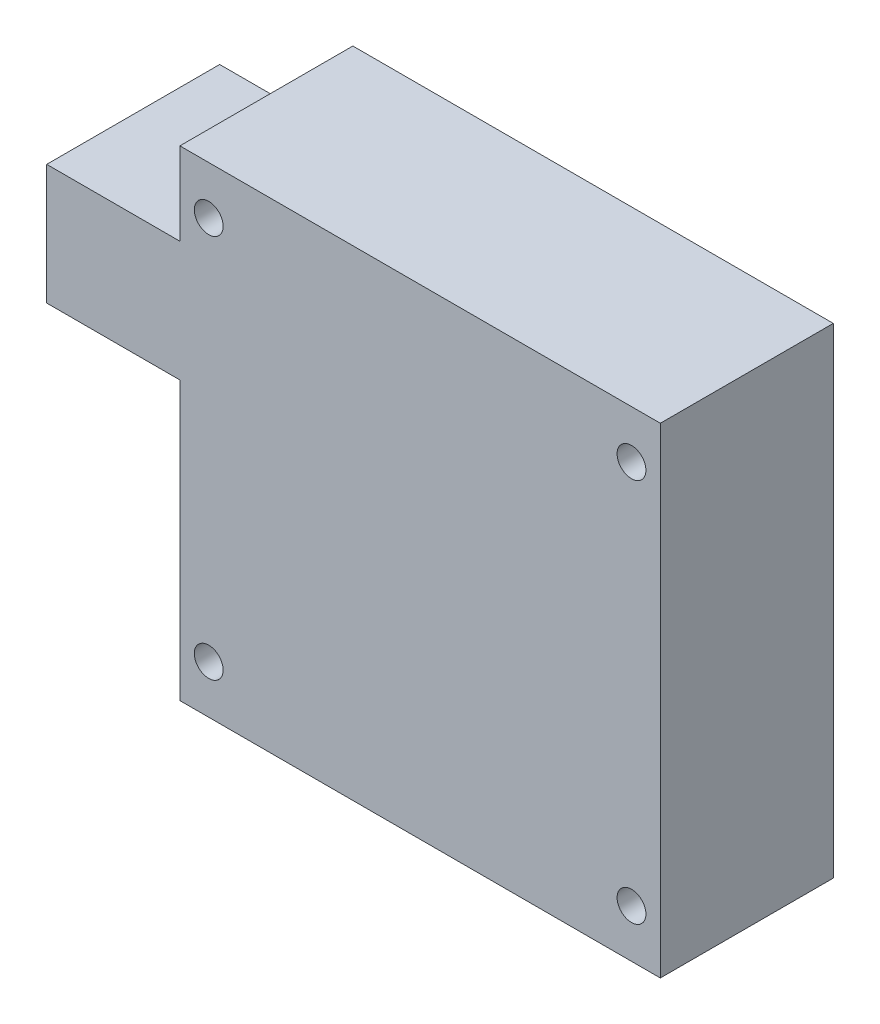
from build123d import *

# Parameters (mm, degrees)
SKETCH_1_W      = 50
SKETCH_1_H      = 50
SKETCH_1_R      = 1.5
EXTRUDE_1_DEPTH = 18
SKETCH_2_W      = 13.860098184
SKETCH_2_H      = 12.505152703
EXTRUDE_2_DEPTH = 18


with BuildPart() as part:
    # 草图1 → 凸台-拉伸1 (new body)
    with BuildSketch(Plane.XY):
        Rectangle(SKETCH_1_W, SKETCH_1_H)
        with Locations((-22, 20)):
            Circle(SKETCH_1_R, mode=Mode.SUBTRACT)
        with Locations((-22, -20)):
            Circle(SKETCH_1_R, mode=Mode.SUBTRACT)
        with Locations((22, 20)):
            Circle(SKETCH_1_R, mode=Mode.SUBTRACT)
        with Locations((22, -20)):
            Circle(SKETCH_1_R, mode=Mode.SUBTRACT)
    extrude(amount=EXTRUDE_1_DEPTH)

    # 草图2 → 凸台-拉伸2 (add)
    with BuildSketch(Plane.XY.offset(18)):
        with Locations((-31.930049092, 10.152032571)):
            Rectangle(SKETCH_2_W, SKETCH_2_H)
    extrude(amount=-EXTRUDE_2_DEPTH)


solid = part.part
